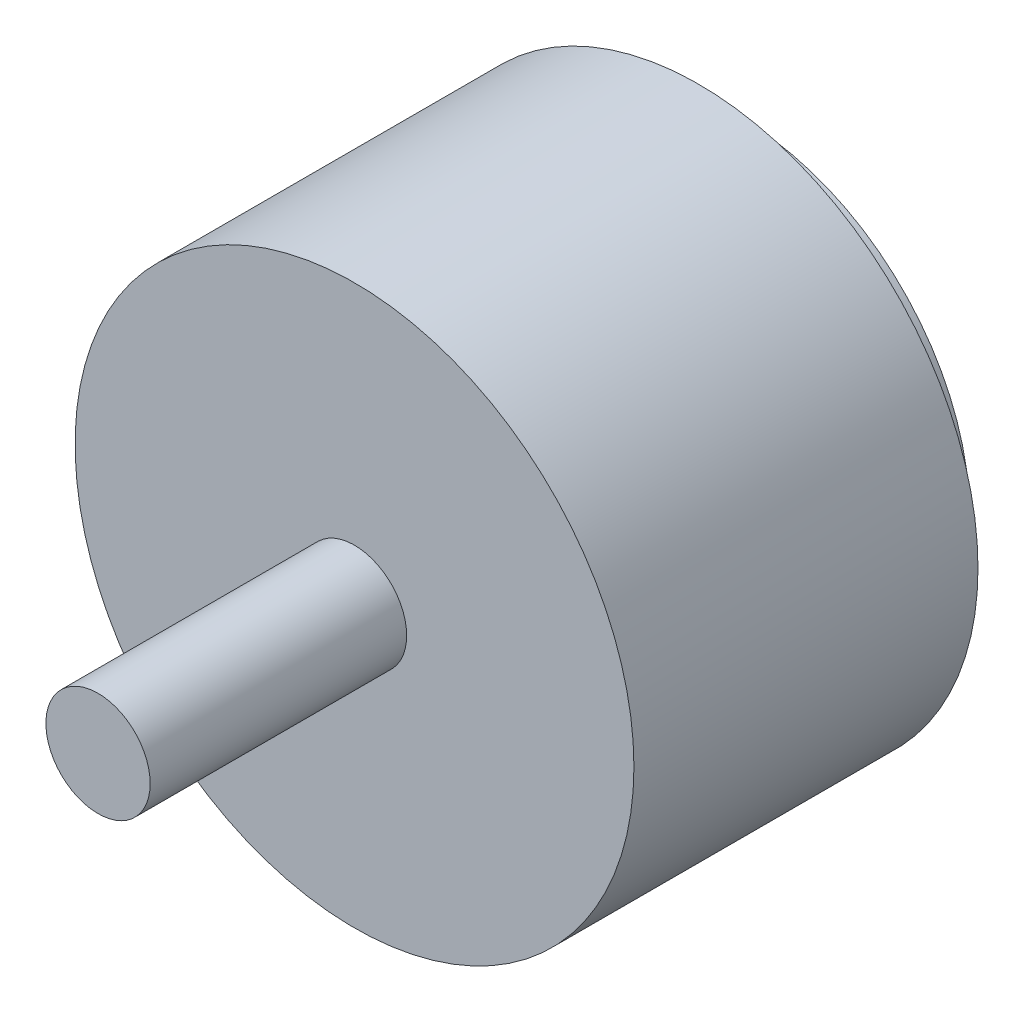
from build123d import *

# Parameters (mm, degrees)
SKETCH_1_R        = 13.4
SKETCH_1_R_2      = 4.5
D26P8H18P5_DEPTH  = 16.5
EXTRUDE_START     = 15
SKETCH_2_R        = 13.4
EXTRUDE_292_DEPTH = 1.5
EXTRUDE_START_2   = -2
SKETCH_3_R        = 11
EXTRUDE_347_DEPTH = 2
EXTRUDE_START_3   = 16.5
SKETCH_4_R        = 2.5
EXTRUDE_M5_DEPTH  = 12.3
D16_M3_START      = -2
SKETCH_5_R        = 1.6
D16_M3_DEPTH      = 5


with BuildPart() as part:
    # 草图1 → 钟罩及定子总包络_D26p8H18p5 (new body)
    with BuildSketch(Plane.XY):
        Circle(SKETCH_1_R)
        Circle(SKETCH_1_R_2, mode=Mode.SUBTRACT)
    extrude(amount=D26P8H18P5_DEPTH)

    # 草图2 → Extrude 292 (add)
    with BuildSketch(Plane.XY.offset(EXTRUDE_START)):
        Circle(SKETCH_2_R)
    extrude(amount=EXTRUDE_292_DEPTH)

    # 草图3 → Extrude 347 (add)
    with BuildSketch(Plane.XY.offset(EXTRUDE_START_2)):
        Circle(SKETCH_3_R)
    extrude(amount=EXTRUDE_347_DEPTH)

    # 草图4 → M5桨轴包络 (add)
    with BuildSketch(Plane.XY.offset(EXTRUDE_START_3)):
        Circle(SKETCH_4_R)
    extrude(amount=EXTRUDE_M5_DEPTH)

    # 草图5 → D16分度圆四M3简化安装孔 (cut)
    with BuildSketch(Plane.XY.offset(D16_M3_START)):
        with Locations((-8, 0)):
            Circle(SKETCH_5_R)
        with Locations((0, -8)):
            Circle(SKETCH_5_R)
        with Locations((8, 0)):
            Circle(SKETCH_5_R)
        with Locations((0, 8)):
            Circle(SKETCH_5_R)
    extrude(amount=D16_M3_DEPTH, mode=Mode.SUBTRACT)


solid = part.part
